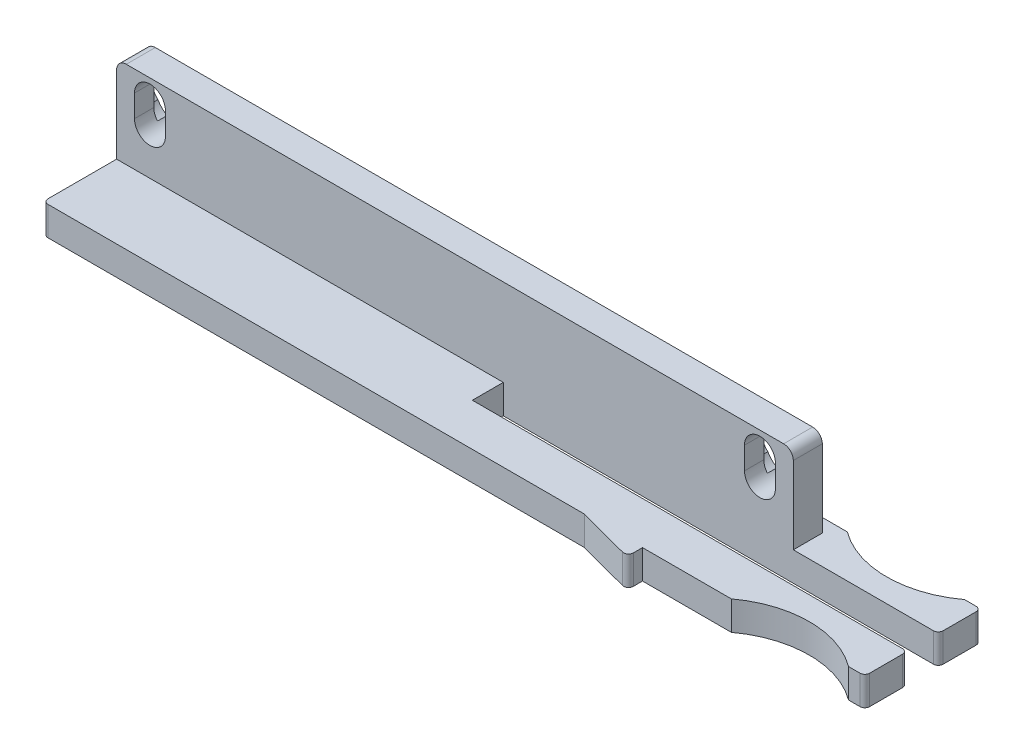
from build123d import *
from build123d.topology import SkipClean

# Parameters (mm, degrees)
EXTRUDE_1_DEPTH     = 3
SKETCH_4_W          = 70
SKETCH_4_H          = 3
EXTRUDE_2_DEPTH     = 9
CUT_EXTRUDE_1_REACH = 88.319
FILLET_1_R          = 1
EXTRUDE_3_DEPTH     = 2


with BuildPart() as part:
    # ｽｹｯﾁ2 → ﾎﾞｽ - 押し出し1 (new body)
    with BuildSketch(Plane(origin=(0, 0, 0), x_dir=(1, 0, 0), z_dir=(0, 1, 0))):
        with BuildLine():
            Line((70, 7.6), (40, 7.6))
            Line((40, 7.6), (40, 4.4))
            Line((40, 4.4), (70, 4.4))
            Line((70, 4.4), (84.5, 4.4))
            ThreePointArc((84.5, 4.4), (84.853553391, 4.253553391), (85, 3.9))
            Line((85, 3.9), (85, 0.5))
            ThreePointArc((85, 0.5), (84.853553391, 0.146446609), (84.5, 0))
            Line((84.5, 0), (83.316300355, 0))
            ThreePointArc((83.316300355, 0), (77.25, 2), (71.183699645, 0))
            Line((71.183699645, 0), (70, 0))
            Line((70, 0), (62, 0))
            Line((62, 0), (62, -0.949194177))
            ThreePointArc((62, -0.949194177), (61.80461807, -1.345688605), (61.371168675, -1.432311647))
            Line((61.371168675, -1.432311647), (56, 0))
            Line((56, 0), (0.5, 0))
            ThreePointArc((0.5, 0), (0.146446609, 0.146446609), (0, 0.5))
            Line((0, 0.5), (0, 11.5))
            ThreePointArc((0, 11.5), (0.146446609, 11.853553391), (0.5, 12))
            Line((0.5, 12), (70, 12))
            Line((70, 12), (71.183699645, 12))
            ThreePointArc((71.183699645, 12), (77.25, 10), (83.316300355, 12))
            Line((83.316300355, 12), (84.5, 12))
            ThreePointArc((84.5, 12), (84.853553391, 11.853553391), (85, 11.5))
            Line((85, 11.5), (85, 8.1))
            ThreePointArc((85, 8.1), (84.853553391, 7.746446609), (84.5, 7.6))
            Line((84.5, 7.6), (70, 7.6))
        make_face()
    extrude(amount=EXTRUDE_1_DEPTH)

    # ｽｹｯﾁ4 → ﾎﾞｽ - 押し出し2 (add)
    with BuildSketch(Plane(origin=(0, 3, 0), x_dir=(1, 0, 0), z_dir=(0, 1, 0))):
        with Locations((35, 9.1)):
            Rectangle(SKETCH_4_W, SKETCH_4_H)
    extrude(amount=EXTRUDE_2_DEPTH)

    # ｽｹｯﾁ5 → ｶｯﾄ - 押し出し1 (cut, up to next)
    with BuildSketch(Plane.XY.offset(-7.6), mode=Mode.PRIVATE) as cut_extrude_1_sk1:
        with BuildLine():
            ThreePointArc((64.370652174, 9.924925734), (63.8, 8.7), (64.370652174, 7.475074266))
            ThreePointArc((64.370652174, 7.475074266), (64.782233047, 6.932233047), (65.325074266, 6.520652174))
            ThreePointArc((65.325074266, 6.520652174), (66.55, 5.95), (67.774925734, 6.520652174))
            ThreePointArc((67.774925734, 6.520652174), (68.317766953, 6.932233047), (68.729347826, 7.475074266))
            ThreePointArc((68.729347826, 7.475074266), (69.3, 8.7), (68.729347826, 9.924925734))
            ThreePointArc((68.729347826, 9.924925734), (68.317766953, 10.467766953), (67.774925734, 10.879347826))
            ThreePointArc((67.774925734, 10.879347826), (66.55, 11.45), (65.325074266, 10.879347826))
            ThreePointArc((65.325074266, 10.879347826), (64.782233047, 10.467766953), (64.370652174, 9.924925734))
        make_face()
    cut_extrude_1_tool1 = extrude(cut_extrude_1_sk1.sketch, amount=-CUT_EXTRUDE_1_REACH, mode=Mode.PRIVATE) & part.part
    # ｽｹｯﾁ5 → ｶｯﾄ - 押し出し1 (cut, up to next)
    with BuildSketch(Plane.XY.offset(-7.6), mode=Mode.PRIVATE) as cut_extrude_1_sk2:
        with BuildLine():
            ThreePointArc((5.629347826, 7.475074266), (6.2, 8.7), (5.629347826, 9.924925734))
            ThreePointArc((5.629347826, 9.924925734), (5.217766953, 10.467766953), (4.674925734, 10.879347826))
            ThreePointArc((4.674925734, 10.879347826), (3.45, 11.45), (2.225074266, 10.879347826))
            ThreePointArc((2.225074266, 10.879347826), (1.682233047, 10.467766953), (1.270652174, 9.924925734))
            ThreePointArc((1.270652174, 9.924925734), (0.7, 8.7), (1.270652174, 7.475074266))
            ThreePointArc((1.270652174, 7.475074266), (1.682233047, 6.932233047), (2.225074266, 6.520652174))
            ThreePointArc((2.225074266, 6.520652174), (3.45, 5.95), (4.674925734, 6.520652174))
            ThreePointArc((4.674925734, 6.520652174), (5.217766953, 6.932233047), (5.629347826, 7.475074266))
        make_face()
    cut_extrude_1_tool2 = extrude(cut_extrude_1_sk2.sketch, amount=-CUT_EXTRUDE_1_REACH, mode=Mode.PRIVATE) & part.part
    add(cut_extrude_1_tool1.solids().sort_by_distance((66.55, 8.7, -7.6))[0], mode=Mode.SUBTRACT)
    add(cut_extrude_1_tool2.solids().sort_by_distance((3.45, 8.7, -7.6))[0], mode=Mode.SUBTRACT)

    # ﾌｨﾚｯﾄ1
    fillet_1_edges = [part.edges().sort_by_distance(p)[0] for p in [
        (70, 12, -9.1),
        (0, 12, -9.1),
    ]]
    fillet(fillet_1_edges, radius=FILLET_1_R)

    # ｽｹｯﾁ6 → ﾎﾞｽ - 押し出し3 (add)
    with SkipClean():  # the faces are left unmerged after this step: merging them gives an invalid solid
        with BuildSketch(Plane.XY.offset(-7.6)):
            with BuildLine():
                Line((1.85, 9.85), (1.85, 7.55))
                ThreePointArc((1.85, 7.55), (1.946690123, 7.002223209), (2.225074266, 6.520652174))
                ThreePointArc((2.225074266, 6.520652174), (1.682233047, 6.932233047), (1.270652174, 7.475074266))
                ThreePointArc((1.270652174, 7.475074266), (0.7, 8.7), (1.270652174, 9.924925734))
                ThreePointArc((1.270652174, 9.924925734), (1.682233047, 10.467766953), (2.225074266, 10.879347826))
                ThreePointArc((2.225074266, 10.879347826), (1.946690123, 10.397776791), (1.85, 9.85))
            make_face()
            with BuildLine():
                Line((5.05, 9.85), (5.05, 7.55))
                ThreePointArc((5.05, 7.55), (4.953309877, 7.002223209), (4.674925734, 6.520652174))
                ThreePointArc((4.674925734, 6.520652174), (5.217766953, 6.932233047), (5.629347826, 7.475074266))
                ThreePointArc((5.629347826, 7.475074266), (6.2, 8.7), (5.629347826, 9.924925734))
                ThreePointArc((5.629347826, 9.924925734), (5.217766953, 10.467766953), (4.674925734, 10.879347826))
                ThreePointArc((4.674925734, 10.879347826), (4.953309877, 10.397776791), (5.05, 9.85))
            make_face()
            with BuildLine():
                Line((64.95, 9.85), (64.95, 7.55))
                ThreePointArc((64.95, 7.55), (65.046690123, 7.002223209), (65.325074266, 6.520652174))
                ThreePointArc((65.325074266, 6.520652174), (64.782233047, 6.932233047), (64.370652174, 7.475074266))
                ThreePointArc((64.370652174, 7.475074266), (63.8, 8.7), (64.370652174, 9.924925734))
                ThreePointArc((64.370652174, 9.924925734), (64.782233047, 10.467766953), (65.325074266, 10.879347826))
                ThreePointArc((65.325074266, 10.879347826), (65.046690123, 10.397776791), (64.95, 9.85))
            make_face()
            with BuildLine():
                Line((68.15, 9.85), (68.15, 7.55))
                ThreePointArc((68.15, 7.55), (68.053309877, 7.002223209), (67.774925734, 6.520652174))
                ThreePointArc((67.774925734, 6.520652174), (68.317766953, 6.932233047), (68.729347826, 7.475074266))
                ThreePointArc((68.729347826, 7.475074266), (69.3, 8.7), (68.729347826, 9.924925734))
                ThreePointArc((68.729347826, 9.924925734), (68.317766953, 10.467766953), (67.774925734, 10.879347826))
                ThreePointArc((67.774925734, 10.879347826), (68.053309877, 10.397776791), (68.15, 9.85))
            make_face()
        extrude(amount=-EXTRUDE_3_DEPTH)


solid = part.part
